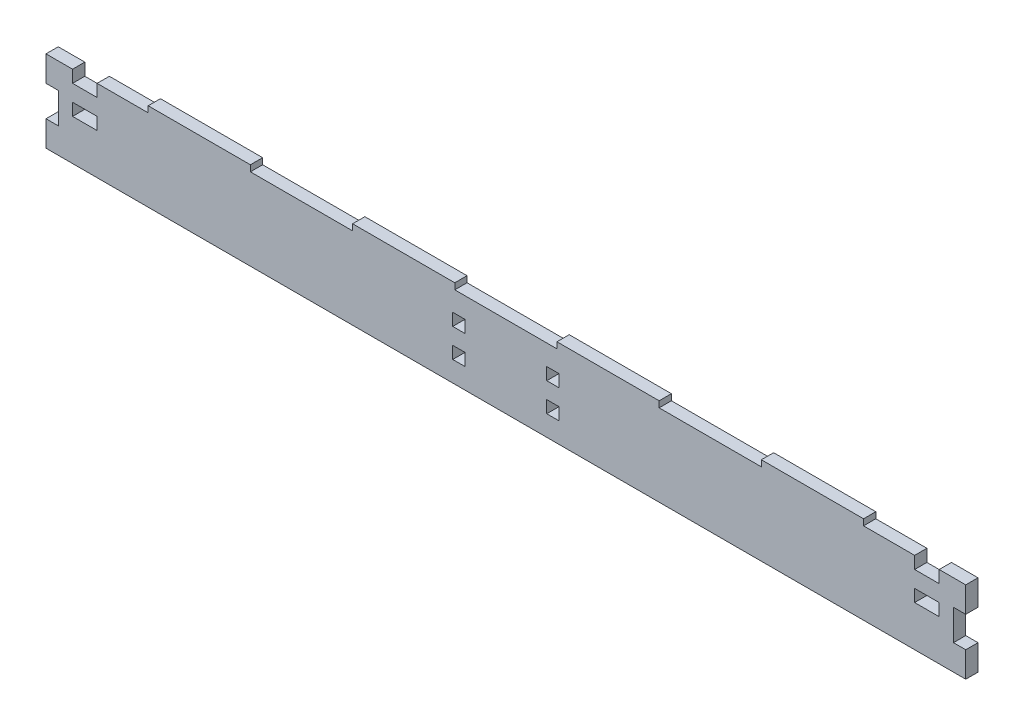
from build123d import *

# Parameters (mm, degrees)
SKETCH_1_W      = 12
SKETCH_1_H      = 6
SKETCH_1_W_2    = 6
EXTRUDE_1_DEPTH = 6


with BuildPart() as part:
    # Эскиз1 → Бобышка-Вытянуть1 (new body)
    with BuildSketch(Plane.XY):
        Polygon((100, 40), (150, 40), (150, 43), (200, 43), (200, 40), (250, 40), (250, 43), (300, 43), (300, 40), (350, 40), (350, 43), (400, 43), (400, 40), (425, 40), (425, 34), (437, 34), (437, 40), (450, 40), (450, 27.5), (444, 27.5), (444, 12.5), (450, 12.5), (450, 0), (0, 0), (0, 12.5), (6, 12.5), (6, 27.5), (0, 27.5), (0, 40), (13, 40), (13, 34), (25, 34), (25, 40), (50, 40), (50, 43), (100, 43), align=None)
        with Locations((19, 23)):
            Rectangle(SKETCH_1_W, SKETCH_1_H, mode=Mode.SUBTRACT)
        with Locations((431, 23)):
            Rectangle(SKETCH_1_W, SKETCH_1_H, mode=Mode.SUBTRACT)
        with Locations((248, 27)):
            Rectangle(SKETCH_1_W_2, SKETCH_1_H, mode=Mode.SUBTRACT)
        with Locations((248, 13)):
            Rectangle(SKETCH_1_W_2, SKETCH_1_H, mode=Mode.SUBTRACT)
        with Locations((202, 27)):
            Rectangle(SKETCH_1_W_2, SKETCH_1_H, mode=Mode.SUBTRACT)
        with Locations((202, 13)):
            Rectangle(SKETCH_1_W_2, SKETCH_1_H, mode=Mode.SUBTRACT)
    extrude(amount=EXTRUDE_1_DEPTH)


solid = part.part
